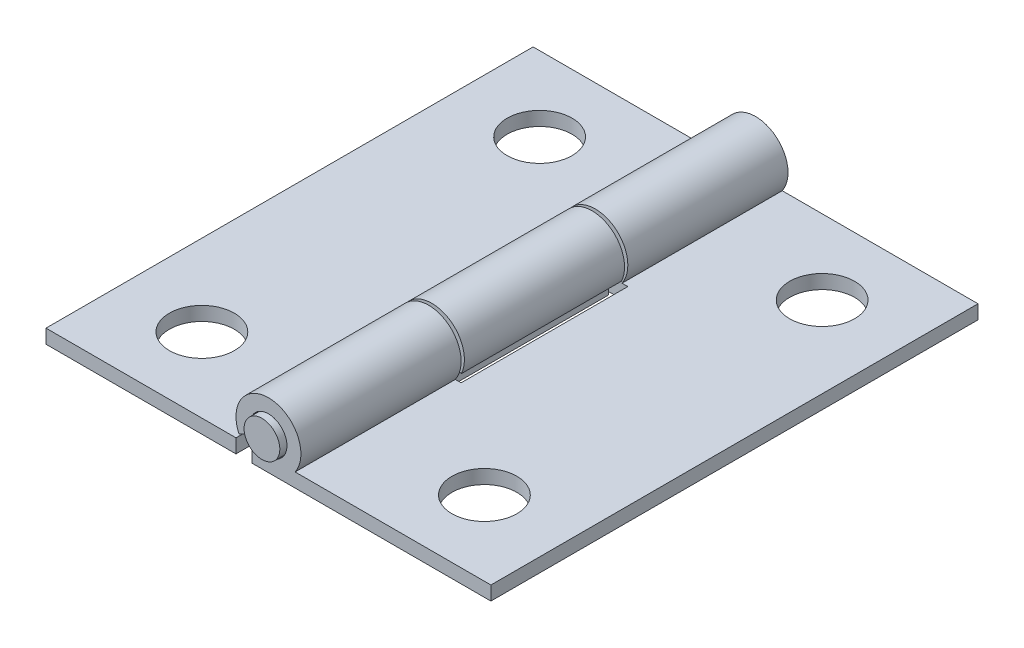
from build123d import *

# Parameters (mm, degrees)
SKETCH1_W           = 14.859
SKETCH1_H           = 38.1
SKETCH1_R           = 2.54
SKETCH1_W_2         = 3.81
SKETCH1_H_2         = 12.530666666
SKETCH1_H_3         = 12.530666667
BOSS_EXTRUDE1_DEPTH = 1.0922
BOSS_EXTRUDE3_DEPTH = 12.530666667
BOSS_EXTRUDE4_START = -25.569333
BOSS_EXTRUDE4_DEPTH = 12.530666667
BOSS_EXTRUDE5_START = -12.784667
BOSS_EXTRUDE5_DEPTH = 12.530666667
BOSS_EXTRUDE6_START = -38.608
SKETCH3_R           = 1.397
BOSS_EXTRUDE6_DEPTH = 39.116


with BuildPart() as part:
    # Sketch1 → Boss-Extrude1 (new body)
    # profile 1 of 5: a face of its own
    with BuildSketch(Plane(origin=(0, 0, 0), x_dir=(1, 0, 0), z_dir=(0, 1, 0))):
        with Locations((7.4295, 19.05)):
            Rectangle(SKETCH1_W, SKETCH1_H)
        with Locations(Location((6.35, 5.842, 0), (0, 0, 270))):
            Circle(SKETCH1_R, mode=Mode.SUBTRACT)
        with Locations(Location((6.35, 32.258, 0), (0, 0, 270))):
            Circle(SKETCH1_R, mode=Mode.SUBTRACT)
    # profile 2 of 5: a face of its own
    with BuildSketch(Plane(origin=(0, 0, 0), x_dir=(1, 0, 0), z_dir=(0, 1, 0))):
        with Locations((27.3685, 19.05)):
            Rectangle(SKETCH1_W, SKETCH1_H)
        with Locations(Location((28.448, 5.842, 0), (0, 0, 270))):
            Circle(SKETCH1_R, mode=Mode.SUBTRACT)
        with Locations(Location((28.448, 32.258, 0), (0, 0, 270))):
            Circle(SKETCH1_R, mode=Mode.SUBTRACT)
    # profile 3 of 5: a face of its own
    with BuildSketch(Plane(origin=(0, 0, 0), x_dir=(1, 0, 0), z_dir=(0, 1, 0))):
        with Locations((16.764, 19.05)):
            Rectangle(SKETCH1_W_2, SKETCH1_H_2)
    # profile 4 of 5: a face of its own
    with BuildSketch(Plane(origin=(0, 0, 0), x_dir=(1, 0, 0), z_dir=(0, 1, 0))):
        with Locations((18.034, 31.834666667)):
            Rectangle(SKETCH1_W_2, SKETCH1_H_3)
    # profile 5 of 5: a face of its own
    with BuildSketch(Plane(origin=(0, 0, 0), x_dir=(1, 0, 0), z_dir=(0, 1, 0))):
        with Locations((18.034, 6.265333334)):
            Rectangle(SKETCH1_W_2, SKETCH1_H_3)
    extrude(amount=BOSS_EXTRUDE1_DEPTH)

    # Sketch2 → Boss-Extrude3 (add)
    with BuildSketch(Plane.XY):
        with BuildLine():
            ThreePointArc((18.711152414, 1.928133281), (18.176902373, 1.318937865), (17.399, 1.0922))
            Line((17.399, 1.0922), (19.485977518, 1.0922))
            ThreePointArc((19.485977518, 1.0922), (19.601467506, 1.27479769), (19.701021779, 1.466549615))
            Line((19.701021779, 1.466549615), (18.711152414, 1.928133281))
        make_face()
        with BuildLine():
            Line((15.096978221, 1.466549615), (16.086847586, 1.928133281))
            ThreePointArc((16.086847586, 1.928133281), (17.085638727, 3.953481359), (18.8468, 2.54))
            ThreePointArc((18.8468, 2.54), (18.812481359, 2.226638727), (18.711152414, 1.928133281))
            Line((18.711152414, 1.928133281), (19.701021779, 1.466549615))
            ThreePointArc((19.701021779, 1.466549615), (19.878791858, 1.990243381), (19.939, 2.54))
            ThreePointArc((19.939, 2.54), (16.849243381, 5.019791858), (15.096978221, 1.466549615))
        make_face()
    extrude(amount=-BOSS_EXTRUDE3_DEPTH)

    # Sketch2<4> → Boss-Extrude4 (add)
    with BuildSketch(Plane.XY.offset(BOSS_EXTRUDE4_START)):
        with BuildLine():
            ThreePointArc((18.711152414, 1.928133281), (18.176902373, 1.318937865), (17.399, 1.0922))
            Line((17.399, 1.0922), (19.485977518, 1.0922))
            ThreePointArc((19.485977518, 1.0922), (19.601467506, 1.27479769), (19.701021779, 1.466549615))
            Line((19.701021779, 1.466549615), (18.711152414, 1.928133281))
        make_face()
        with BuildLine():
            Line((15.096978221, 1.466549615), (16.086847586, 1.928133281))
            ThreePointArc((16.086847586, 1.928133281), (17.085638727, 3.953481359), (18.8468, 2.54))
            ThreePointArc((18.8468, 2.54), (18.812481359, 2.226638727), (18.711152414, 1.928133281))
            Line((18.711152414, 1.928133281), (19.701021779, 1.466549615))
            ThreePointArc((19.701021779, 1.466549615), (19.878791858, 1.990243381), (19.939, 2.54))
            ThreePointArc((19.939, 2.54), (16.849243381, 5.019791858), (15.096978221, 1.466549615))
        make_face()
    extrude(amount=-BOSS_EXTRUDE4_DEPTH)

    # Sketch2<5> → Boss-Extrude5 (add)
    with BuildSketch(Plane.XY.offset(BOSS_EXTRUDE5_START)):
        with BuildLine():
            Line((16.129, 1.0922), (17.399, 1.0922))
            ThreePointArc((17.399, 1.0922), (16.621097627, 1.318937865), (16.086847586, 1.928133281))
            Line((16.086847586, 1.928133281), (15.096978221, 1.466549615))
            ThreePointArc((15.096978221, 1.466549615), (15.196532494, 1.27479769), (15.312022482, 1.0922))
            Line((15.312022482, 1.0922), (16.129, 1.0922))
        make_face()
        with BuildLine():
            Line((15.096978221, 1.466549615), (16.086847586, 1.928133281))
            ThreePointArc((16.086847586, 1.928133281), (17.085638727, 3.953481359), (18.8468, 2.54))
            ThreePointArc((18.8468, 2.54), (18.812481359, 2.226638727), (18.711152414, 1.928133281))
            Line((18.711152414, 1.928133281), (19.701021779, 1.466549615))
            ThreePointArc((19.701021779, 1.466549615), (19.878791858, 1.990243381), (19.939, 2.54))
            ThreePointArc((19.939, 2.54), (16.849243381, 5.019791858), (15.096978221, 1.466549615))
        make_face()
    extrude(amount=-BOSS_EXTRUDE5_DEPTH)


with BuildPart() as body_2:
    # Sketch3 → Boss-Extrude6 (new body)
    with BuildSketch(Plane(origin=(0, 0, -38.1), x_dir=(-1, 0, 0), z_dir=(0, 0, -1)).offset(BOSS_EXTRUDE6_START)):
        with Locations((-17.399, 2.54)):
            Circle(SKETCH3_R)
    extrude(amount=BOSS_EXTRUDE6_DEPTH)


solid = Compound([part.part, body_2.part])
